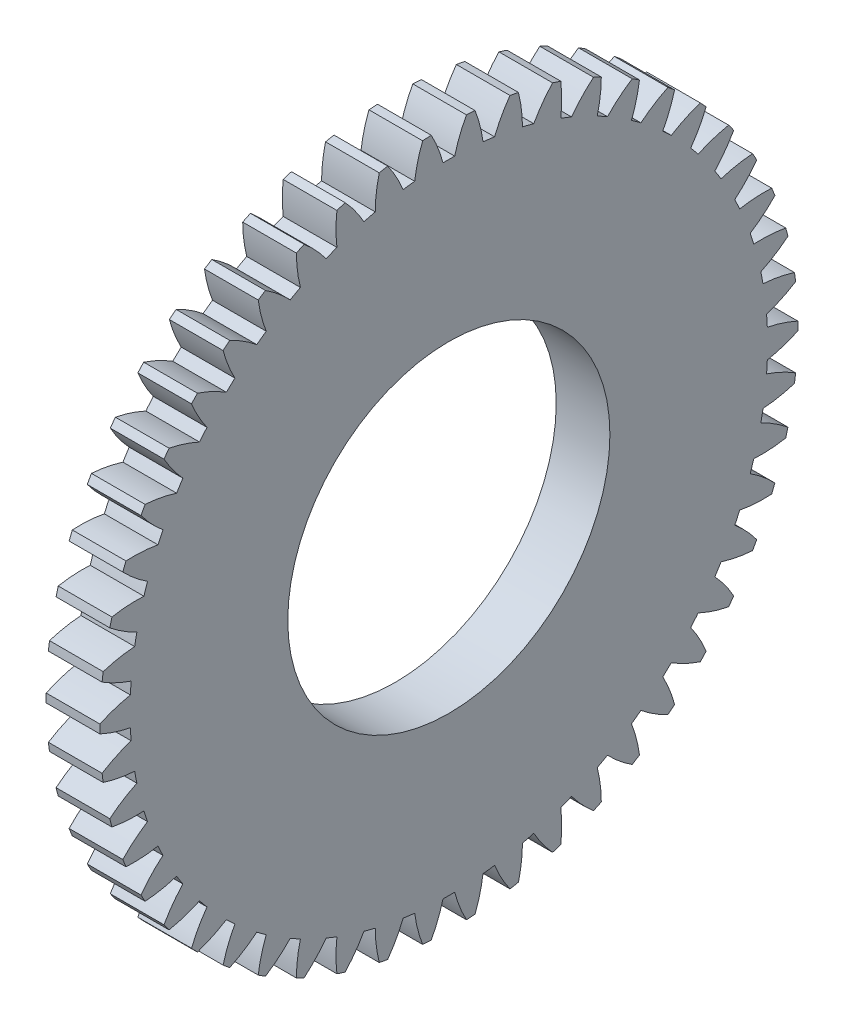
from build123d import *

# Parameters (mm, degrees)
BASPROSKE_W     = 5
BASPROSKE_H     = 32.5
TOOTHCUT_DEPTH  = 47.233105022
TEETHCUTS_COUNT = 50
TEETHCUTS_ANGLE = 352.8
BORSKE_R        = 15
BORE_DEPTH      = 50.0001016


with BuildPart() as part:
    # BasProSke → Base-Revolve (revolve)
    with BuildSketch(Plane(origin=(0, 0, 0), x_dir=(1, 0, 0), z_dir=(0, 1, 0)), mode=Mode.PRIVATE) as base_revolve_sk:
        with Locations((2.5, 16.25)):
            Rectangle(BASPROSKE_W, BASPROSKE_H)
    revolve(base_revolve_sk.sketch.rotate(Axis((-10, 0, 0), (1, 0, 0)), 180), axis=Axis((-10, 0, 0), (1, 0, 0)))

    # TooCutSke → ToothCut (cut, through all)
    with BuildSketch(Plane(origin=(0, 0, 0), x_dir=(0, 0, -1), z_dir=(1, 0, 0))):
        with BuildLine():
            ThreePointArc((0.542987455, 29.681533769), (0, 29.6865), (-0.542987455, 29.681533769))
            ThreePointArc((-0.542987455, 29.681533769), (-1.01367548, 31.116033427), (-1.653872687, 32.483324188))
            ThreePointArc((-1.653872687, 32.483324188), (0, 32.5254), (1.653872687, 32.483324188))
            ThreePointArc((1.653872687, 32.483324188), (1.01367548, 31.116033427), (0.542987455, 29.681533769))
        make_face()
    toothcut = extrude(amount=TOOTHCUT_DEPTH, mode=Mode.SUBTRACT)

    # TeethCuts: ToothCut ×50 about axis
    teethcuts_axis = Axis((-10, 0, 0), (1, 0, 0))
    for i in range(1, TEETHCUTS_COUNT):
        add(toothcut.rotate(teethcuts_axis, i * TEETHCUTS_ANGLE / (TEETHCUTS_COUNT - 1)), mode=Mode.SUBTRACT)

    # BorSke → Bore (cut, symmetric)
    with BuildSketch(Plane(origin=(0, 0, 0), x_dir=(0, 0, -1), z_dir=(1, 0, 0))):
        with Locations(Location((0, 0, 0), (0, 0, 180))):
            Circle(BORSKE_R)
    extrude(amount=BORE_DEPTH, both=True, mode=Mode.SUBTRACT)


solid = part.part
